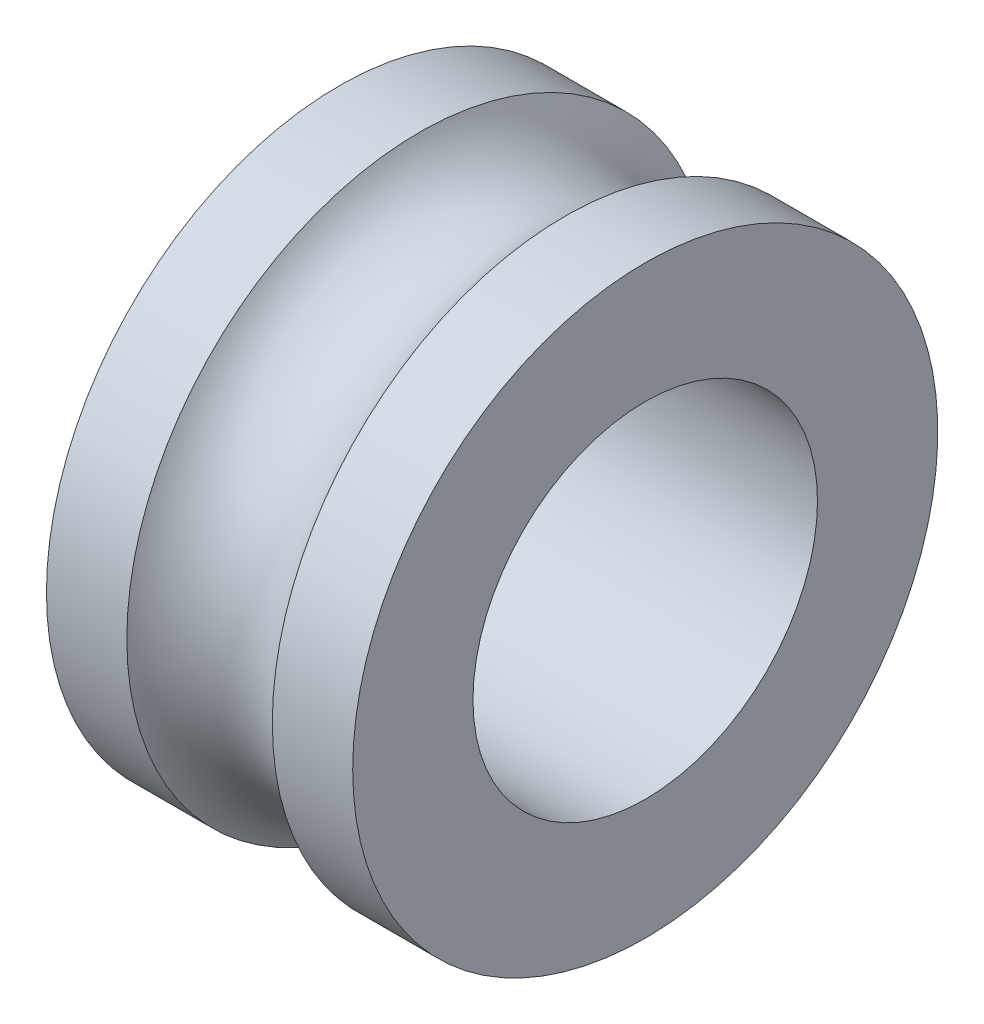
from build123d import *


with BuildPart() as part:
    # Sketch1 → Revolve1 (revolve)
    with BuildSketch(Plane.XY, mode=Mode.PRIVATE) as revolve1_sk:
        with BuildLine():
            Line((0, 0), (4, 0))
            Line((4, 0), (4, 3.142))
            Line((4, 3.142), (1.9, 3.142))
            ThreePointArc((1.9, 3.142), (0, 2.051053651), (-1.9, 3.142))
            Line((-1.9, 3.142), (-4, 3.142))
            Line((-4, 3.142), (-4, 0))
            Line((-4, 0), (0, 0))
        make_face()
    revolve(revolve1_sk.sketch.rotate(Axis((-4, -4.5, 0), (1, 0, 0)), 90), axis=Axis((-4, -4.5, 0), (1, 0, 0)))


solid = part.part
